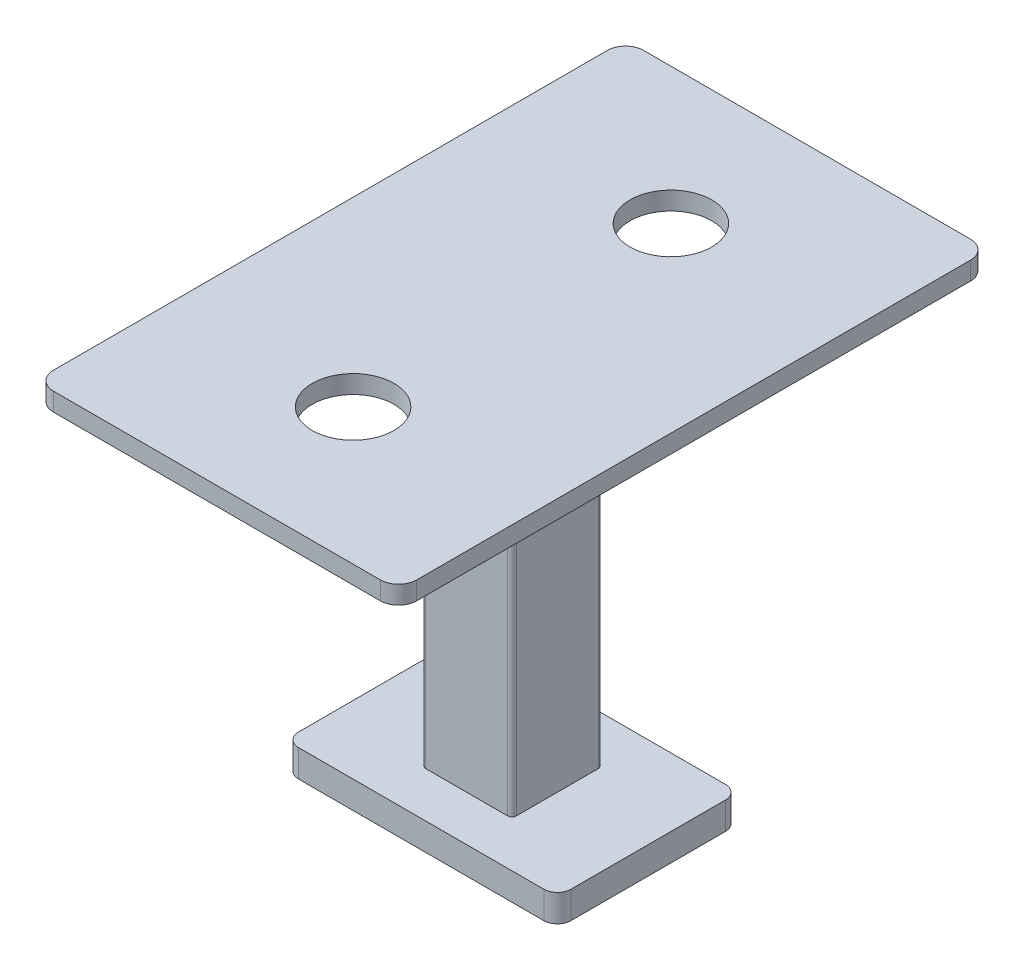
from build123d import *

# Parameters (mm, degrees)
BOSS_EXTRUDE1_DEPTH = 3
BOSS_EXTRUDE2_DEPTH = 41
BOSS_EXTRUDE3_DEPTH = 2
SKETCH5_R           = 4.5
CUT_EXTRUDE1_DEPTH  = 2


with BuildPart() as part:
    # Sketch1 → Boss-Extrude1 (new body)
    with BuildSketch(Plane(origin=(0, 0, 0), x_dir=(1, 0, 0), z_dir=(0, 1, 0))):
        with BuildLine():
            Line((1.5, 0), (28.5, 0))
            ThreePointArc((28.5, 0), (29.560660172, 0.439339828), (30, 1.5))
            Line((30, 1.5), (30, 18.5))
            ThreePointArc((30, 18.5), (29.560660172, 19.560660172), (28.5, 20))
            Line((28.5, 20), (1.5, 20))
            ThreePointArc((1.5, 20), (0.439339828, 19.560660172), (0, 18.5))
            Line((0, 18.5), (0, 1.5))
            ThreePointArc((0, 1.5), (0.439339828, 0.439339828), (1.5, 0))
        make_face()
    extrude(amount=BOSS_EXTRUDE1_DEPTH)

    # Sketch3 → Boss-Extrude2 (add)
    with BuildSketch(Plane(origin=(0, 3, 0), x_dir=(1, 0, 0), z_dir=(0, 1, 0))):
        with BuildLine():
            Line((10.5, 5), (19.5, 5))
            ThreePointArc((19.5, 5), (19.853553391, 5.146446609), (20, 5.5))
            Line((20, 5.5), (20, 14.5))
            ThreePointArc((20, 14.5), (19.853553391, 14.853553391), (19.5, 15))
            Line((19.5, 15), (10.5, 15))
            ThreePointArc((10.5, 15), (10.146446609, 14.853553391), (10, 14.5))
            Line((10, 14.5), (10, 5.5))
            ThreePointArc((10, 5.5), (10.146446609, 5.146446609), (10.5, 5))
        make_face()
    extrude(amount=BOSS_EXTRUDE2_DEPTH)

    # Sketch4 → Boss-Extrude3 (add)
    with BuildSketch(Plane(origin=(0, 44, 0), x_dir=(1, 0, 0), z_dir=(0, 1, 0))):
        with BuildLine():
            Line((33, -22.5), (-3, -22.5))
            ThreePointArc((-3, -22.5), (-4.414213562, -21.914213562), (-5, -20.5))
            Line((-5, -20.5), (-5, 40.5))
            ThreePointArc((-5, 40.5), (-4.414213562, 41.914213562), (-3, 42.5))
            Line((-3, 42.5), (33, 42.5))
            ThreePointArc((33, 42.5), (34.414213562, 41.914213562), (35, 40.5))
            Line((35, 40.5), (35, -20.5))
            ThreePointArc((35, -20.5), (34.414213562, -21.914213562), (33, -22.5))
        make_face()
    extrude(amount=BOSS_EXTRUDE3_DEPTH)

    # Sketch5 → Cut-Extrude1 (cut)
    with BuildSketch(Plane(origin=(0, 46, 0), x_dir=(1, 0, 0), z_dir=(0, 1, 0))):
        with Locations(Location((15, 27.5, 0), (0, 0, 270))):
            Circle(SKETCH5_R)
        with Locations(Location((15, -7.5, 0), (0, 0, 270))):
            Circle(SKETCH5_R)
    extrude(amount=-CUT_EXTRUDE1_DEPTH, mode=Mode.SUBTRACT)


solid = part.part
